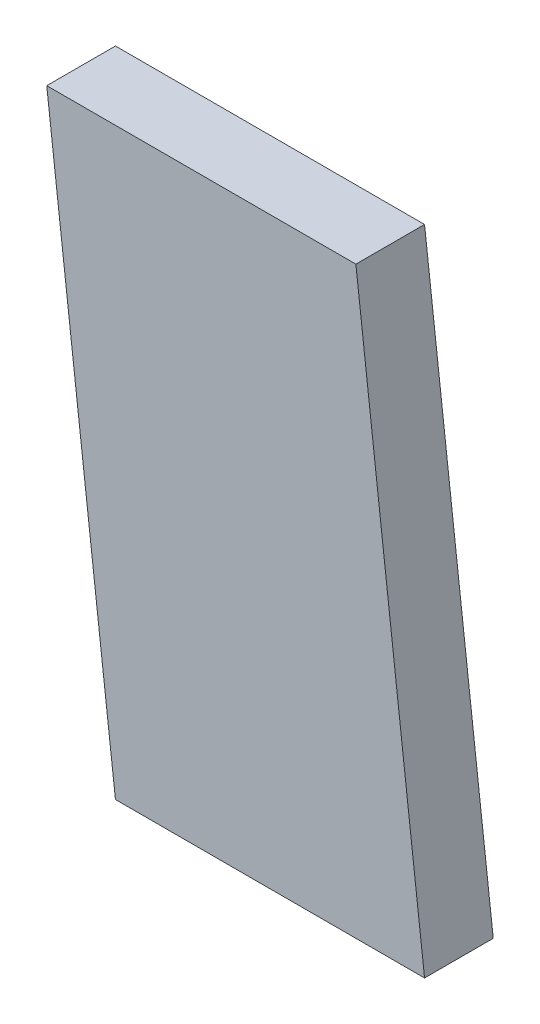
from build123d import *

# Parameters (mm, degrees)
BOSS_EXTRUDE1_DEPTH = 20


with BuildPart() as part:
    # Sketch1 → Boss-Extrude1 (new body)
    with BuildSketch(Plane.XY):
        Polygon((5200, 490), (5180, 660), (5270, 660), (5290, 490), align=None)
    extrude(amount=BOSS_EXTRUDE1_DEPTH)


solid = part.part
